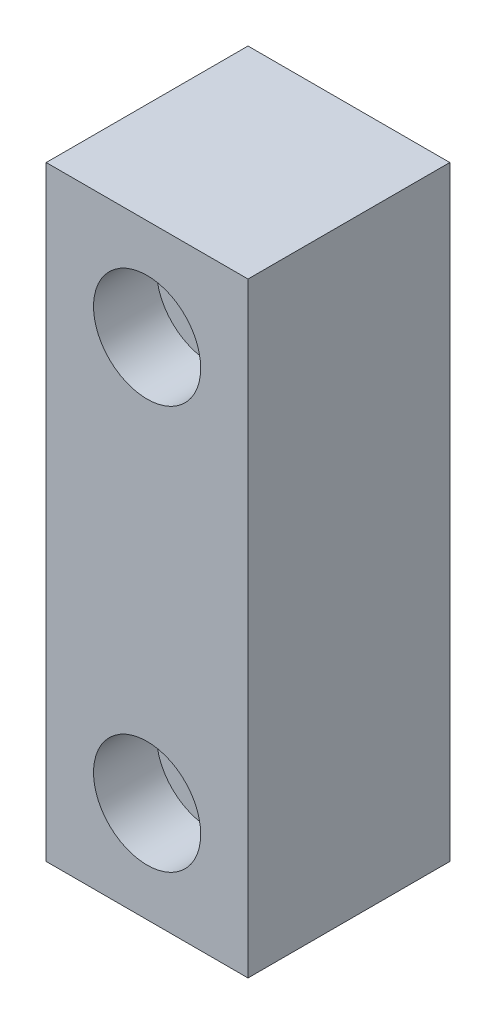
from build123d import *

# Parameters (mm, degrees)
SKETCH1_W                                         = 76.2
SKETCH1_H                                         = 25.4
BOSS_EXTRUDE1_DEPTH                               = 12.7
CBORE_FOR_5_16_SOCKET_HEAD_CAP_SCREW1_D           = 8.7376
CBORE_FOR_5_16_SOCKET_HEAD_CAP_SCREW1_DEPTH       = 25.4
CBORE_FOR_5_16_SOCKET_HEAD_CAP_SCREW1_CBORE_D     = 13.4874
CBORE_FOR_5_16_SOCKET_HEAD_CAP_SCREW1_CBORE_DEPTH = 7.9248
CBORE_FOR_5_16_SOCKET_HEAD_CAP_SCREW1_TIP         = 2.625039872
CBORE_FOR_5_16_SOCKET_HEAD_CAP_SCREW2_D           = 8.7376
CBORE_FOR_5_16_SOCKET_HEAD_CAP_SCREW2_DEPTH       = 25.4
CBORE_FOR_5_16_SOCKET_HEAD_CAP_SCREW2_CBORE_D     = 13.4874
CBORE_FOR_5_16_SOCKET_HEAD_CAP_SCREW2_CBORE_DEPTH = 7.9248
CBORE_FOR_5_16_SOCKET_HEAD_CAP_SCREW2_TIP         = 2.625039872


with BuildPart() as part:
    # Sketch1 → Boss-Extrude1 (new, symmetric)
    with BuildSketch(Plane(origin=(0, 0, 0), x_dir=(0, 1, 0), z_dir=(0, 0, 1))):
        Rectangle(SKETCH1_W, SKETCH1_H)
    extrude(amount=BOSS_EXTRUDE1_DEPTH, both=True)

    # CBORE for 5/16 Socket Head Cap Screw1
    with Locations(Plane.XY.offset(12.7)):
        with Locations((0, -25.4)):
            CounterBoreHole(CBORE_FOR_5_16_SOCKET_HEAD_CAP_SCREW1_D / 2, CBORE_FOR_5_16_SOCKET_HEAD_CAP_SCREW1_CBORE_D / 2, CBORE_FOR_5_16_SOCKET_HEAD_CAP_SCREW1_CBORE_DEPTH, depth=CBORE_FOR_5_16_SOCKET_HEAD_CAP_SCREW1_DEPTH)
            with Locations((0, 0, -(CBORE_FOR_5_16_SOCKET_HEAD_CAP_SCREW1_DEPTH + CBORE_FOR_5_16_SOCKET_HEAD_CAP_SCREW1_TIP / 2))):  # 118° drill point
                Cone(0, CBORE_FOR_5_16_SOCKET_HEAD_CAP_SCREW1_D / 2, CBORE_FOR_5_16_SOCKET_HEAD_CAP_SCREW1_TIP, mode=Mode.SUBTRACT)

    # CBORE for 5/16 Socket Head Cap Screw2
    with Locations(Plane.XY.offset(12.7)):
        with Locations((0, 25.4)):
            CounterBoreHole(CBORE_FOR_5_16_SOCKET_HEAD_CAP_SCREW2_D / 2, CBORE_FOR_5_16_SOCKET_HEAD_CAP_SCREW2_CBORE_D / 2, CBORE_FOR_5_16_SOCKET_HEAD_CAP_SCREW2_CBORE_DEPTH, depth=CBORE_FOR_5_16_SOCKET_HEAD_CAP_SCREW2_DEPTH)
            with Locations((0, 0, -(CBORE_FOR_5_16_SOCKET_HEAD_CAP_SCREW2_DEPTH + CBORE_FOR_5_16_SOCKET_HEAD_CAP_SCREW2_TIP / 2))):  # 118° drill point
                Cone(0, CBORE_FOR_5_16_SOCKET_HEAD_CAP_SCREW2_D / 2, CBORE_FOR_5_16_SOCKET_HEAD_CAP_SCREW2_TIP, mode=Mode.SUBTRACT)


solid = part.part
